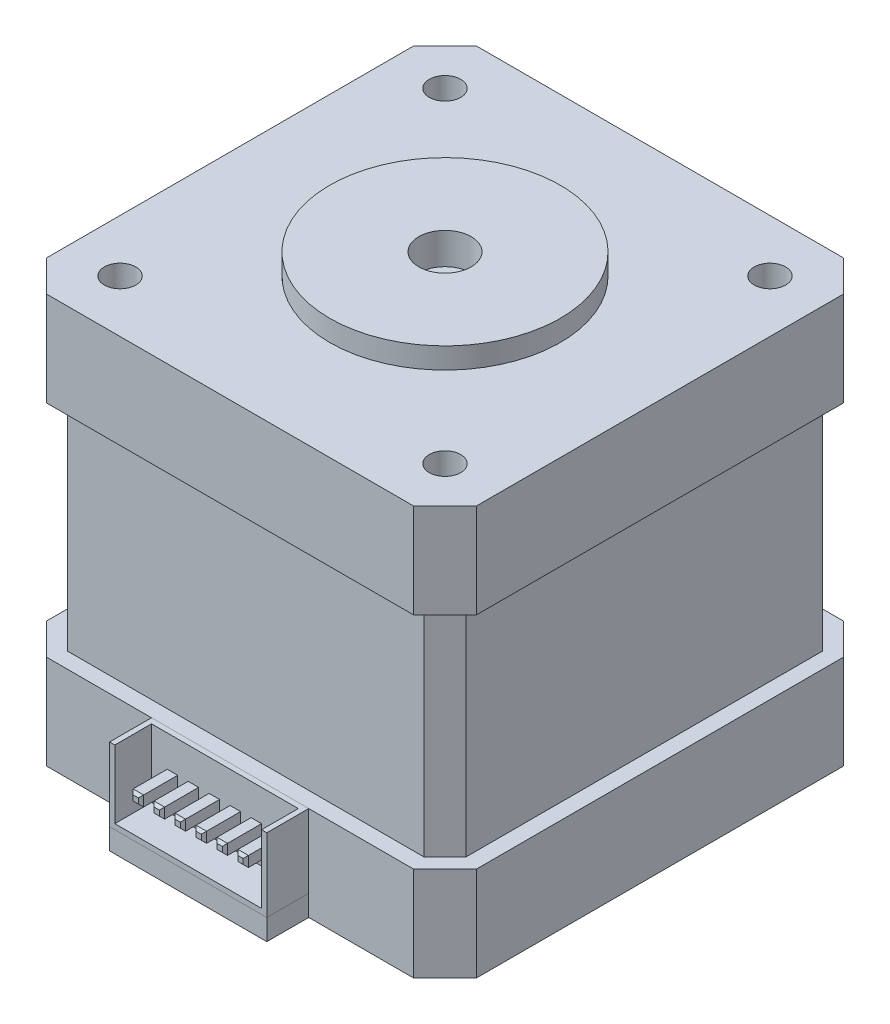
from build123d import *

# Parameters (mm, degrees)
SKETCH2_W           = 41
SKETCH2_H           = 41
BOSS_EXTRUDE1_DEPTH = 39
CHAMFER1_SIZE       = 3
SKETCH3_R           = 1.5
CUT_EXTRUDE1_DEPTH  = 4
SKETCH4_R           = 11
BOSS_EXTRUDE2_DEPTH = 2
CUT_EXTRUDE3_START  = -9
SKETCH7_OUTSIDE_W   = 57.202
SKETCH7_OUTSIDE_H   = 57.202
SKETCH7_OUTSIDE_W_2 = 38
SKETCH7_OUTSIDE_H_2 = 38
CUT_EXTRUDE3_DEPTH  = 21
CHAMFER5_SIZE       = 2
SKETCH5_R           = 2.5
CUT_EXTRUDE4_DEPTH  = 3
SKETCH8_W           = 15
SKETCH8_H           = 2
BOSS_EXTRUDE3_DEPTH = 4
SKETCH8_4_W         = 15
SKETCH8_4_H         = 7
SKETCH8_4_W_2       = 1
SKETCH8_4_H_2       = 1
BOSS_EXTRUDE4_DEPTH = 0.5
BOSS_EXTRUDE5_DEPTH = 4
SKETCH8_6_W         = 1
SKETCH8_6_H         = 1
BOSS_EXTRUDE6_DEPTH = 4
CHAMFER6_SIZE       = 0.25


with BuildPart() as part:
    # Sketch2 → Boss-Extrude1 (new body)
    with BuildSketch(Plane(origin=(0, 0, 0), x_dir=(1, 0, 0), z_dir=(0, 1, 0))):
        Rectangle(SKETCH2_W, SKETCH2_H)
    extrude(amount=BOSS_EXTRUDE1_DEPTH)

    # Chamfer1
    chamfer1_edges = [part.edges().sort_by_distance(p)[0] for p in [
        (20.5, 19.5, 20.5),
        (-20.5, 19.5, 20.5),
        (-20.5, 19.5, -20.5),
        (20.5, 19.5, -20.5),
    ]]
    chamfer(chamfer1_edges, length=CHAMFER1_SIZE)

    # Sketch3 → Cut-Extrude1 (cut)
    with BuildSketch(Plane(origin=(0, 39, 0), x_dir=(1, 0, 0), z_dir=(0, 1, 0))):
        with Locations((-15.5, -15.5)):
            Circle(SKETCH3_R)
        with Locations((15.5, -15.5)):
            Circle(SKETCH3_R)
        with Locations((-15.5, 15.5)):
            Circle(SKETCH3_R)
        with Locations((15.5, 15.5)):
            Circle(SKETCH3_R)
    cut_extrude1 = extrude(amount=-CUT_EXTRUDE1_DEPTH, mode=Mode.SUBTRACT)

    # Mirror1: Cut-Extrude1 across plane
    add(cut_extrude1.mirror(Plane(origin=(0, 19.5, 0), x_dir=(0, 0, 1), z_dir=(0, -1, 0))), mode=Mode.SUBTRACT)

    # Sketch4 → Boss-Extrude2 (add)
    with BuildSketch(Plane(origin=(0, 39, 0), x_dir=(1, 0, 0), z_dir=(0, 1, 0))):
        Circle(SKETCH4_R)
    extrude(amount=BOSS_EXTRUDE2_DEPTH)

    # Sketch7 outside → Cut-Extrude3 (cut)
    with BuildSketch(Plane.XZ.offset(CUT_EXTRUDE3_START)):
        Rectangle(SKETCH7_OUTSIDE_W, SKETCH7_OUTSIDE_H)
        Rectangle(SKETCH7_OUTSIDE_W_2, SKETCH7_OUTSIDE_H_2, mode=Mode.SUBTRACT)
    extrude(amount=-CUT_EXTRUDE3_DEPTH, mode=Mode.SUBTRACT)

    # Chamfer5
    chamfer5_edges = [part.edges().sort_by_distance(p)[0] for p in [
        (-19, 19.5, 19),
        (-19, 19.5, -19),
        (19, 19.5, -19),
        (19, 19.5, 19),
    ]]
    chamfer(chamfer5_edges, length=CHAMFER5_SIZE)

    # Sketch5 → Cut-Extrude4 (cut)
    with BuildSketch(Plane(origin=(0, 41, 0), x_dir=(1, 0, 0), z_dir=(0, 1, 0))):
        Circle(SKETCH5_R)
    extrude(amount=-CUT_EXTRUDE4_DEPTH, mode=Mode.SUBTRACT)

    # Sketch8 → Boss-Extrude3 (add)
    with BuildSketch(Plane.XY.offset(20.5)):
        with Locations((0, 1)):
            Rectangle(SKETCH8_W, SKETCH8_H)
    extrude(amount=BOSS_EXTRUDE3_DEPTH)

    # Sketch8<6> → Boss-Extrude6 (add)
    with BuildSketch(Plane.XY.offset(20.5)):
        with Locations((3, 5.5)):
            Rectangle(SKETCH8_6_W, SKETCH8_6_H)
        with Locations((5, 5.5)):
            Rectangle(SKETCH8_6_W, SKETCH8_6_H)
        with Locations((1, 5.5)):
            Rectangle(SKETCH8_6_W, SKETCH8_6_H)
        with Locations((-1, 5.5)):
            Rectangle(SKETCH8_6_W, SKETCH8_6_H)
        with Locations((-3, 5.5)):
            Rectangle(SKETCH8_6_W, SKETCH8_6_H)
        with Locations((-5, 5.5)):
            Rectangle(SKETCH8_6_W, SKETCH8_6_H)
    extrude(amount=BOSS_EXTRUDE6_DEPTH)

    # Chamfer6
    chamfer6_edges = [part.edges().sort_by_distance(p)[0] for p in [
        (4.5, 5.5, 24.5),
        (5, 6, 24.5),
        (5.5, 5.5, 24.5),
        (5, 5, 24.5),
        (3.5, 5.5, 24.5),
        (3, 5, 24.5),
        (2.5, 5.5, 24.5),
        (3, 6, 24.5),
        (1.5, 5.5, 24.5),
        (1, 5, 24.5),
        (0.5, 5.5, 24.5),
        (1, 6, 24.5),
        (-0.5, 5.5, 24.5),
        (-1, 5, 24.5),
        (-1.5, 5.5, 24.5),
        (-1, 6, 24.5),
        (-2.5, 5.5, 24.5),
        (-3, 5, 24.5),
        (-3.5, 5.5, 24.5),
        (-3, 6, 24.5),
        (-4.5, 5.5, 24.5),
        (-5, 5, 24.5),
        (-5.5, 5.5, 24.5),
        (-5, 6, 24.5),
    ]]
    chamfer(chamfer6_edges, length=CHAMFER6_SIZE)


with BuildPart() as body_2:
    # Sketch8<4> → Boss-Extrude4 (new body)
    with BuildSketch(Plane.XY.offset(20.5)):
        with Locations((0, 5.5)):
            Rectangle(SKETCH8_4_W, SKETCH8_4_H)
        with Locations((3, 5.5)):
            Rectangle(SKETCH8_4_W_2, SKETCH8_4_H_2, mode=Mode.SUBTRACT)
        with Locations((5, 5.5)):
            Rectangle(SKETCH8_4_W_2, SKETCH8_4_H_2, mode=Mode.SUBTRACT)
        with Locations((-5, 5.5)):
            Rectangle(SKETCH8_4_W_2, SKETCH8_4_H_2, mode=Mode.SUBTRACT)
        with Locations((-3, 5.5)):
            Rectangle(SKETCH8_4_W_2, SKETCH8_4_H_2, mode=Mode.SUBTRACT)
        with Locations((-1, 5.5)):
            Rectangle(SKETCH8_4_W_2, SKETCH8_4_H_2, mode=Mode.SUBTRACT)
        with Locations((1, 5.5)):
            Rectangle(SKETCH8_4_W_2, SKETCH8_4_H_2, mode=Mode.SUBTRACT)
    extrude(amount=BOSS_EXTRUDE4_DEPTH)


with BuildPart() as body_3:
    # Sketch8<5> → Boss-Extrude5 (new body)
    with BuildSketch(Plane.XY.offset(20.5)):
        Polygon((-7.5, 9), (-7.5, 2), (7.5, 2), (7.5, 9), (7, 9), (7, 8.5), (7, 2.5), (-7, 2.5), (-7, 8.5), (-7, 9), align=None)
    extrude(amount=BOSS_EXTRUDE5_DEPTH)


with BuildPart() as body_2_1:
    add(body_2.part)

    # Combine1: union body 3
    add(body_3.part)


solid = Compound([part.part, body_2_1.part])
